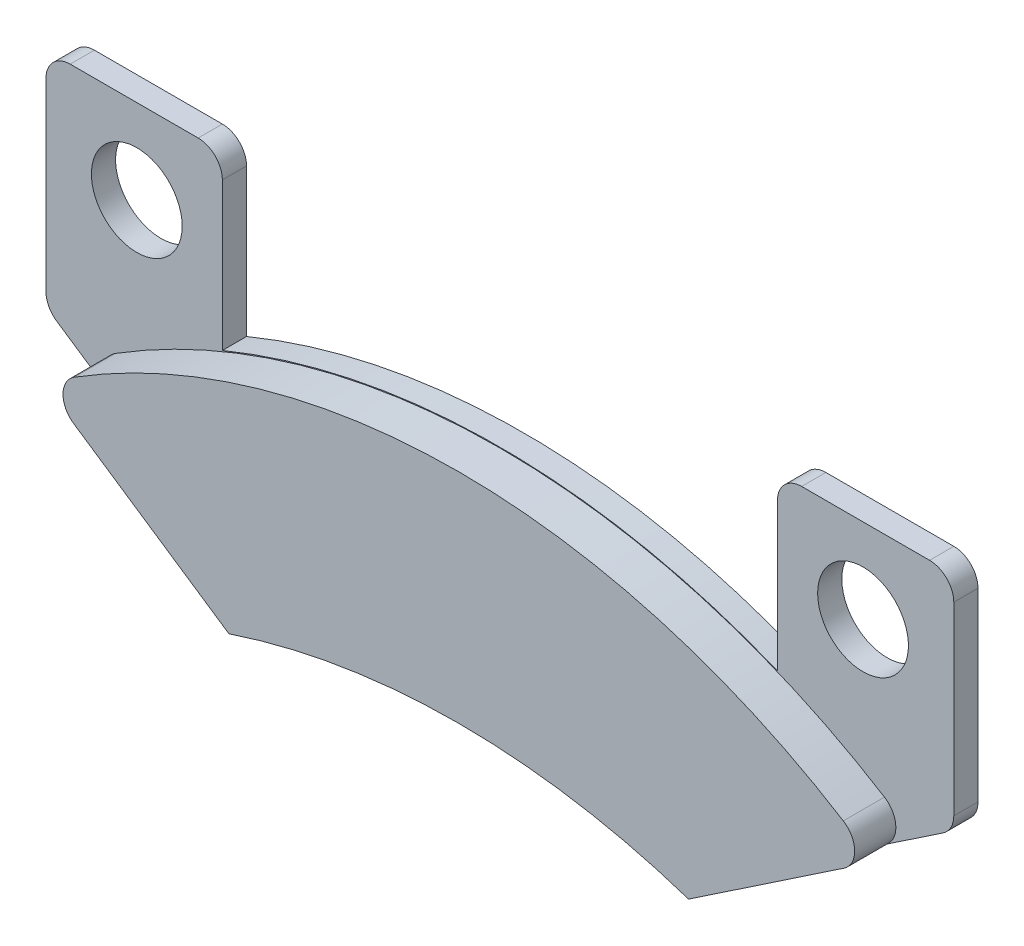
from build123d import *

# Parameters (mm, degrees)
SKETCH1_R           = 4.762500000000004
BOSS_EXTRUDE1_DEPTH = 2.54
BOSS_EXTRUDE2_DEPTH = 4.318
FILLET1_R           = 2.54


with BuildPart() as part:
    # Sketch1 → Boss-Extrude1 (new body)
    with BuildSketch(Plane.XY):
        with BuildLine():
            Line((-29.12070870680529, -1.1283392484503774), (-29.12070870680529, 16.90683065104644))
            Line((-29.12070870680529, 16.90683065104644), (-47.625, 16.906830651046437))
            Line((-47.625, 16.906830651046437), (-47.625, -6.402026683274578))
            Line((-47.625, -6.402026683274578), (-24.11489201542563, -22.209169348953562))
            ThreePointArc((-24.11489201542563, -22.209169348953562), (4.67e-15, -18.29272199465825), (24.11489201542563, -22.209169348953562))
            Line((24.11489201542563, -22.209169348953562), (47.625, -6.402026683274578))
            Line((47.625, -6.402026683274578), (47.625, 16.906830651046437))
            Line((47.625, 16.906830651046437), (29.12070870680529, 16.90683065104644))
            Line((29.12070870680529, 16.90683065104644), (29.12070870680529, -1.1283392484503774))
            ThreePointArc((29.12070870680529, -1.1283392484503774), (4.67e-15, 4.6555807384347645), (-29.12070870680529, -1.1283392484503774))
        make_face()
        with Locations((-38.099999999999994, 8.048015683552894)):
            Circle(SKETCH1_R, mode=Mode.SUBTRACT)
        with Locations(Location((38.099999999999994, 8.048015683552894, 0), (0, 0, 180))):
            Circle(SKETCH1_R, mode=Mode.SUBTRACT)
    extrude(amount=BOSS_EXTRUDE1_DEPTH)

    # Sketch2 → Boss-Extrude2 (add)
    with BuildSketch(Plane.XY.offset(2.54)):
        with BuildLine():
            Line((-43.56033013161569, -9.13492848621798), (-24.114892015425625, -22.209169348953562))
            ThreePointArc((-24.114892015425625, -22.209169348953562), (4.67e-15, -18.29272199465825), (24.11489201542563, -22.209169348953562))
            Line((24.11489201542563, -22.209169348953562), (43.58710776229448, -9.11692440777367))
            ThreePointArc((43.58710776229448, -9.11692440777367), (0.01055892070138382, 4.5719736134911955), (-43.56033013161569, -9.13492848621798))
        make_face()
    extrude(amount=BOSS_EXTRUDE2_DEPTH)

    # Fillet1
    fillet1_edges = [part.edges().sort_by_distance(p)[0] for p in [
        (47.625, -6.402026683274578, 1.27),
        (-47.625, -6.402026683274578, 1.27),
        (-47.625, 16.906830651046437, 1.27),
        (-29.12070870680529, 16.90683065104644, 1.27),
        (29.12070870680529, 16.90683065104644, 1.27),
        (47.625, 16.906830651046437, 1.27),
        (43.58710776229448, -9.116924407773672, 4.699),
        (-43.56033013161569, -9.13492848621799, 4.699),
    ]]
    fillet(fillet1_edges, radius=FILLET1_R)


solid = part.part
